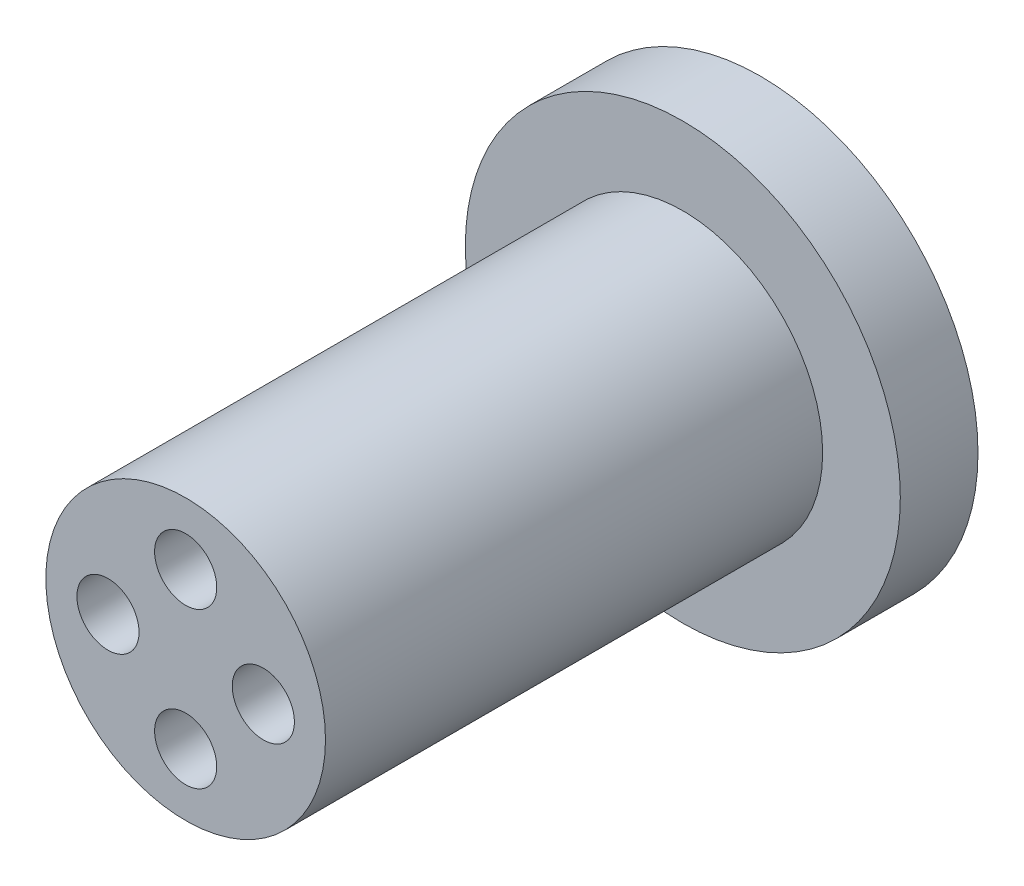
from build123d import *

# Parameters (mm, degrees)
SKETCH1_R           = 7
BOSS_EXTRUDE1_DEPTH = 2.5
SKETCH2_R           = 4.5
BOSS_EXTRUDE2_DEPTH = 16
SKETCH3_R           = 1
CUT_EXTRUDE1_DEPTH  = 5


with BuildPart() as part:
    # Sketch1 → Boss-Extrude1 (new body)
    with BuildSketch(Plane.XY):
        Circle(SKETCH1_R)
    extrude(amount=BOSS_EXTRUDE1_DEPTH)

    # Sketch2 → Boss-Extrude2 (add)
    with BuildSketch(Plane.XY.offset(2.5)):
        Circle(SKETCH2_R)
    extrude(amount=BOSS_EXTRUDE2_DEPTH)

    # Sketch3 → Cut-Extrude1 (cut)
    with BuildSketch(Plane.XY.offset(18.5)):
        with Locations((0, 2.5)):
            Circle(SKETCH3_R)
        with Locations((2.5, 0)):
            Circle(SKETCH3_R)
        with Locations((0, -2.5)):
            Circle(SKETCH3_R)
        with Locations((-2.5, 0)):
            Circle(SKETCH3_R)
    extrude(amount=-CUT_EXTRUDE1_DEPTH, mode=Mode.SUBTRACT)


solid = part.part
